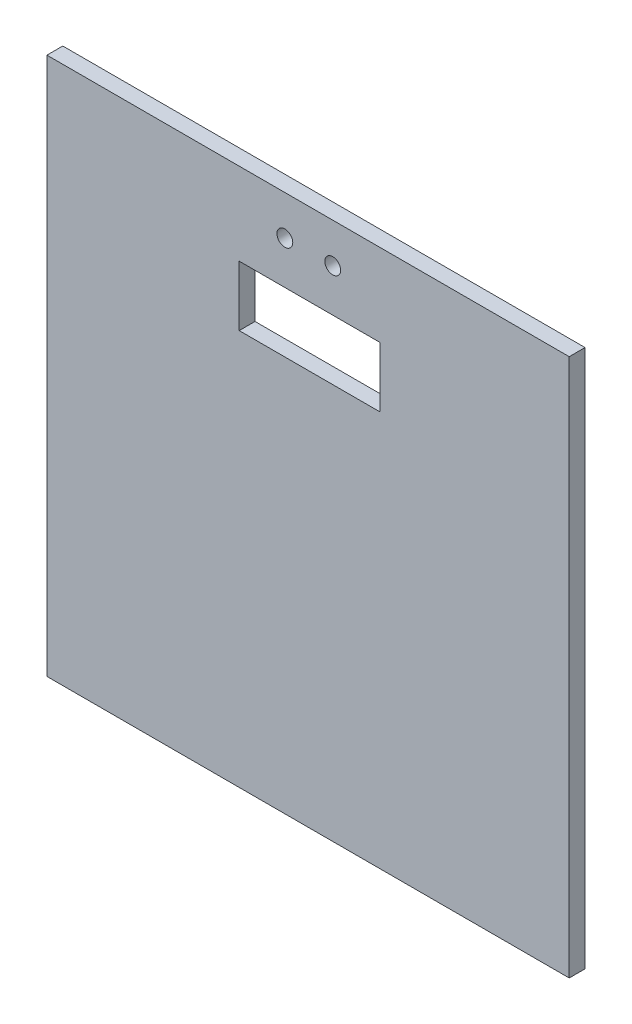
from build123d import *

# Parameters (mm, degrees)
SKETCH1_W           = 66
SKETCH1_H           = 68
SKETCH1_R           = 1
SKETCH1_W_2         = 17.8
SKETCH1_H_2         = 7.6
BOSS_EXTRUDE1_DEPTH = 2


with BuildPart() as part:
    # Sketch1 → Boss-Extrude1 (new body)
    with BuildSketch(Plane.XY.offset(30)):
        with Locations((251.940861289, 301.024014524)):
            Rectangle(SKETCH1_W, SKETCH1_H)
        with Locations((249.003592831, 330.031505481)):
            Circle(SKETCH1_R, mode=Mode.SUBTRACT)
        with Locations((255.055282531, 330.031505481)):
            Circle(SKETCH1_R, mode=Mode.SUBTRACT)
        with Locations((252.135035756, 320.823888471)):
            Rectangle(SKETCH1_W_2, SKETCH1_H_2, mode=Mode.SUBTRACT)
    extrude(amount=BOSS_EXTRUDE1_DEPTH)


solid = part.part
